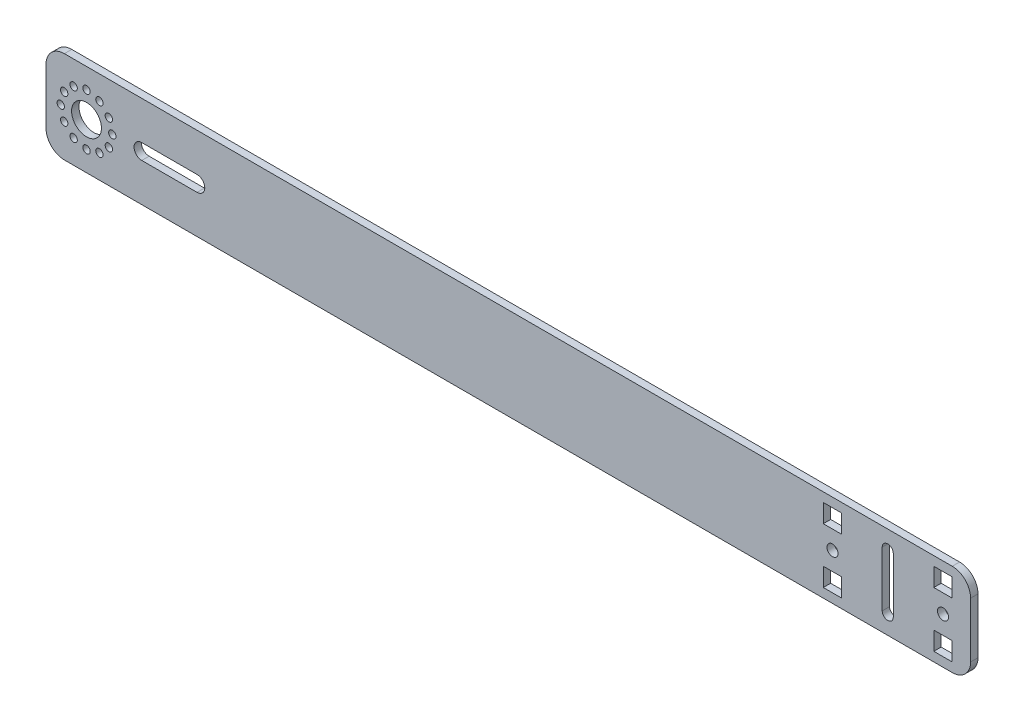
from build123d import *

# Parameters (mm, degrees)
ESQUISSE2_W             = 251
ESQUISSE2_H             = 25
ESQUISSE2_R             = 4.05
ESQUISSE2_R_2           = 1
ESQUISSE2_R_3           = 1.5
ESQUISSE2_W_2           = 5
ESQUISSE2_H_2           = 5
BOSS_EXTRU_1_DEPTH      = 2
CONG_1_R                = 5
ESQUISSE3_R             = 1.5
ESQUISSE3_W             = 5
ESQUISSE3_H             = 5
ENL_V_MAT_EXTRU_1_DEPTH = 10


with BuildPart() as part:
    # Esquisse2 → Boss.-Extru.1 (new body)
    with BuildSketch(Plane(origin=(0, 0, 0), x_dir=(-1, 0, 0), z_dir=(0, 0, -1))):
        with Locations((-125.5, 0)):
            Rectangle(ESQUISSE2_W, ESQUISSE2_H)
        with Locations((-11, 0)):
            Circle(ESQUISSE2_R, mode=Mode.SUBTRACT)
        with Locations((-4, 0)):
            Circle(ESQUISSE2_R_2, mode=Mode.SUBTRACT)
        with Locations((-4.937822174, -3.5)):
            Circle(ESQUISSE2_R_2, mode=Mode.SUBTRACT)
        with Locations((-7.5, -6.062177826)):
            Circle(ESQUISSE2_R_2, mode=Mode.SUBTRACT)
        with Locations((-11, -7)):
            Circle(ESQUISSE2_R_2, mode=Mode.SUBTRACT)
        with Locations((-14.5, -6.062177826)):
            Circle(ESQUISSE2_R_2, mode=Mode.SUBTRACT)
        with Locations((-17.062177826, -3.5)):
            Circle(ESQUISSE2_R_2, mode=Mode.SUBTRACT)
        with Locations((-18, 0)):
            Circle(ESQUISSE2_R_2, mode=Mode.SUBTRACT)
        with Locations((-17.062177826, 3.5)):
            Circle(ESQUISSE2_R_2, mode=Mode.SUBTRACT)
        with Locations((-14.5, 6.062177826)):
            Circle(ESQUISSE2_R_2, mode=Mode.SUBTRACT)
        with Locations((-11, 7)):
            Circle(ESQUISSE2_R_2, mode=Mode.SUBTRACT)
        with Locations((-7.5, 6.062177826)):
            Circle(ESQUISSE2_R_2, mode=Mode.SUBTRACT)
        with Locations((-4.937822174, 3.5)):
            Circle(ESQUISSE2_R_2, mode=Mode.SUBTRACT)
        with Locations((-243.5, 0)):
            Circle(ESQUISSE2_R_3, mode=Mode.SUBTRACT)
        with BuildLine():
            Line((-26, -2.1), (-41, -2.1))
            ThreePointArc((-41, -2.1), (-43.1, 0), (-41, 2.1))
            Line((-41, 2.1), (-26, 2.1))
            ThreePointArc((-26, 2.1), (-23.9, 0), (-26, -2.1))
        make_face(mode=Mode.SUBTRACT)
        with Locations((-243.5, -7.5)):
            Rectangle(ESQUISSE2_W_2, ESQUISSE2_H_2, mode=Mode.SUBTRACT)
        with Locations((-243.5, 7.5)):
            Rectangle(ESQUISSE2_W_2, ESQUISSE2_H_2, mode=Mode.SUBTRACT)
    extrude(amount=-BOSS_EXTRU_1_DEPTH)

    # Congé1
    cong_1_edges = [part.edges().sort_by_distance(p)[0] for p in [
        (251, 12.5, 1),
        (0, 12.5, 1),
        (0, -12.5, 1),
        (251, -12.5, 1),
    ]]
    fillet(cong_1_edges, radius=CONG_1_R)

    # Esquisse3 → Enlèv. mat.-Extru.1 (cut)
    with BuildSketch(Plane(origin=(0, 0, 0), x_dir=(-1, 0, 0), z_dir=(0, 0, -1))):
        with Locations((-243.5, 0)):
            Circle(ESQUISSE3_R)
        with Locations((-213.5, 0)):
            Circle(ESQUISSE3_R)
        with Locations((-243.5, -7.5)):
            Rectangle(ESQUISSE3_W, ESQUISSE3_H)
        with Locations((-243.5, 7.5)):
            Rectangle(ESQUISSE3_W, ESQUISSE3_H)
        with Locations((-213.5, -7.5)):
            Rectangle(ESQUISSE3_W, ESQUISSE3_H)
        with Locations((-213.5, 7.5)):
            Rectangle(ESQUISSE3_W, ESQUISSE3_H)
        with BuildLine():
            Line((-230, -7.5), (-230, 7.5))
            ThreePointArc((-230, 7.5), (-228.5, 9), (-227, 7.5))
            Line((-227, 7.5), (-227, -7.5))
            ThreePointArc((-227, -7.5), (-228.5, -9), (-230, -7.5))
        make_face()
    extrude(amount=-ENL_V_MAT_EXTRU_1_DEPTH, mode=Mode.SUBTRACT)


solid = part.part
